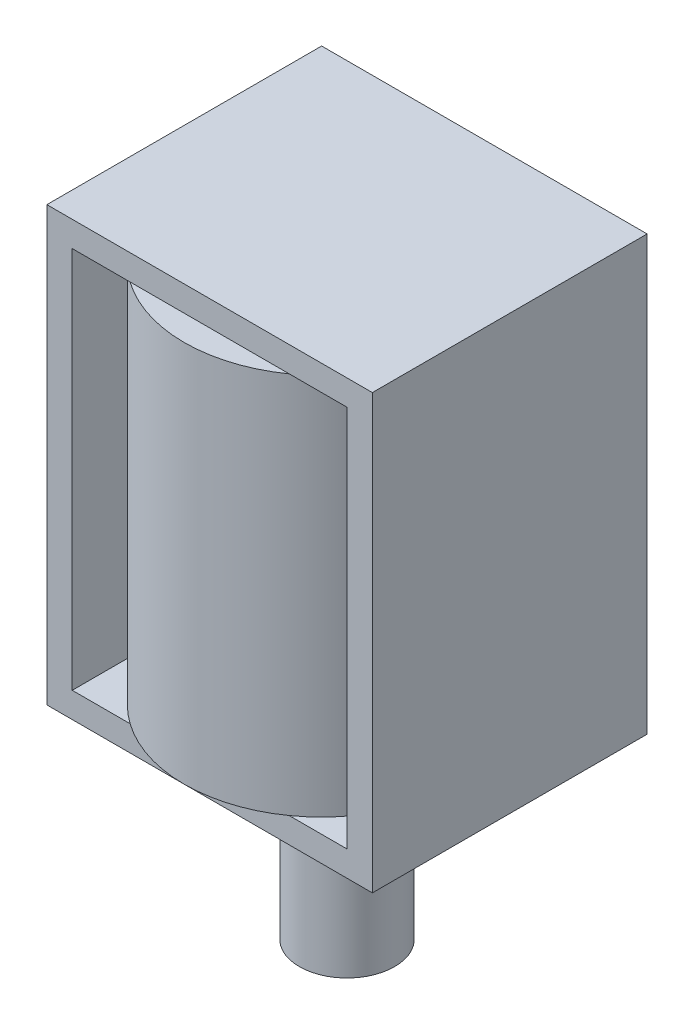
from build123d import *

# Parameters (mm, degrees)
ESQUISSE1_W        = 15.4
ESQUISSE1_H        = 20.5
ESQUISSE1_W_2      = 13
ESQUISSE1_H_2      = 18.1
BOSS_EXTRU_1_DEPTH = 6.5
ESQUISSE2_R        = 2.25
BOSS_EXTRU_2_DEPTH = 9
BOSS_EXTRU_3_DEPTH = 18.1


with BuildPart() as part:
    # Esquisse1 → Boss.-Extru.1 (new, symmetric)
    with BuildSketch(Plane.XY):
        with Locations((0, 10.25)):
            Rectangle(ESQUISSE1_W, ESQUISSE1_H)
        with Locations((0, 10.25)):
            Rectangle(ESQUISSE1_W_2, ESQUISSE1_H_2, mode=Mode.SUBTRACT)
    extrude(amount=BOSS_EXTRU_1_DEPTH, both=True)

    # Esquisse2 → Boss.-Extru.2 (add)
    with BuildSketch(Plane.XZ):
        with Locations(Location((0, 0, 0), (0, 0, 90))):
            Circle(ESQUISSE2_R)
    extrude(amount=BOSS_EXTRU_2_DEPTH)

    # Esquisse3 → Boss.-Extru.3 (add)
    with BuildSketch(Plane(origin=(0, 1.2, 0), x_dir=(1, 0, 0), z_dir=(0, 1, 0))):
        with BuildLine():
            Line((6.5, 0), (6.5, -1.2))
            ThreePointArc((6.5, -1.2), (0, -7.7), (-6.5, -1.2))
            Line((-6.5, -1.2), (-6.5, 0))
            ThreePointArc((-6.5, 0), (0, 6.5), (6.5, 0))
        make_face()
    extrude(amount=BOSS_EXTRU_3_DEPTH)


solid = part.part
